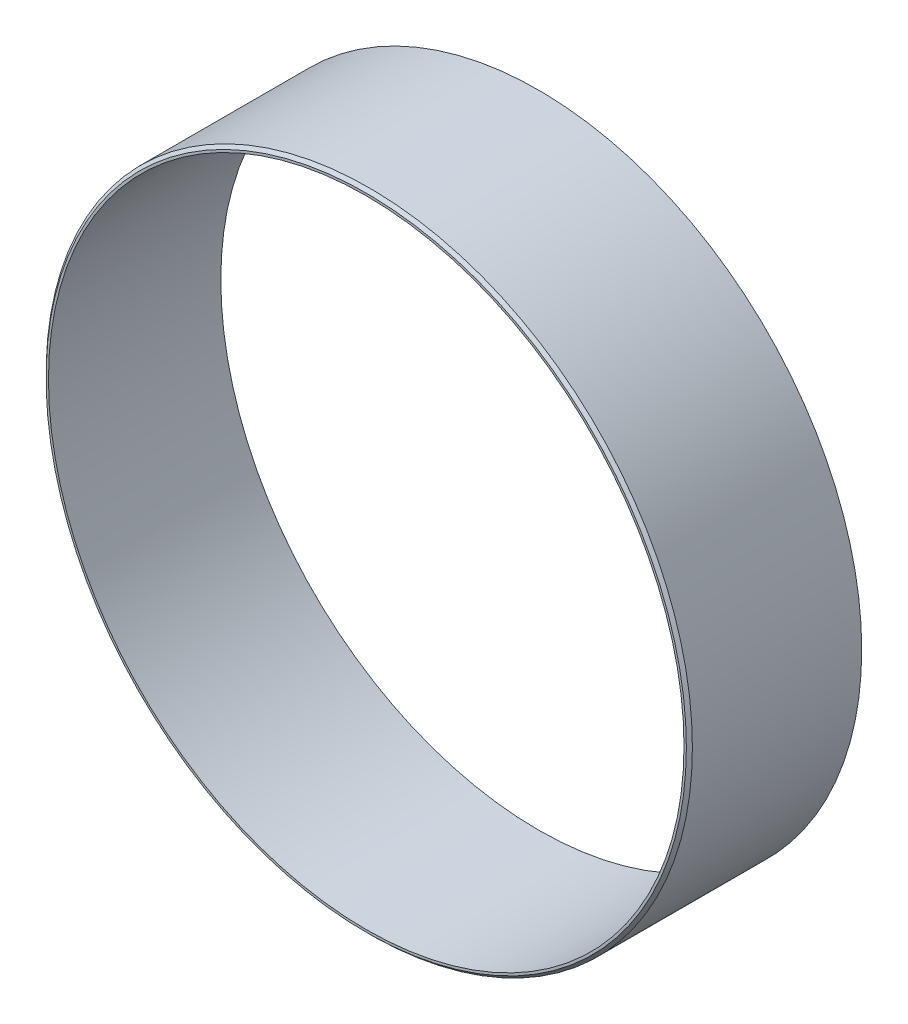
from build123d import *

# Parameters (mm, degrees)
SCHIZZO1_R                   = 75
SCHIZZO1_R_2                 = 73.75
ESTRUSIONE_ESTRUSIONE1_DEPTH = 40
SMUSSO1_SIZE                 = 0.7


with BuildPart() as part:
    # Schizzo1 → Estrusione-Estrusione1 (new body)
    with BuildSketch(Plane.XY):
        Circle(SCHIZZO1_R)
        Circle(SCHIZZO1_R_2, mode=Mode.SUBTRACT)
    extrude(amount=ESTRUSIONE_ESTRUSIONE1_DEPTH)

    # Smusso1
    smusso1_edges = [part.edges().sort_by_distance(p)[0] for p in [
        (-75, 0, 40),
    ]]
    chamfer(smusso1_edges, length=SMUSSO1_SIZE)


solid = part.part
